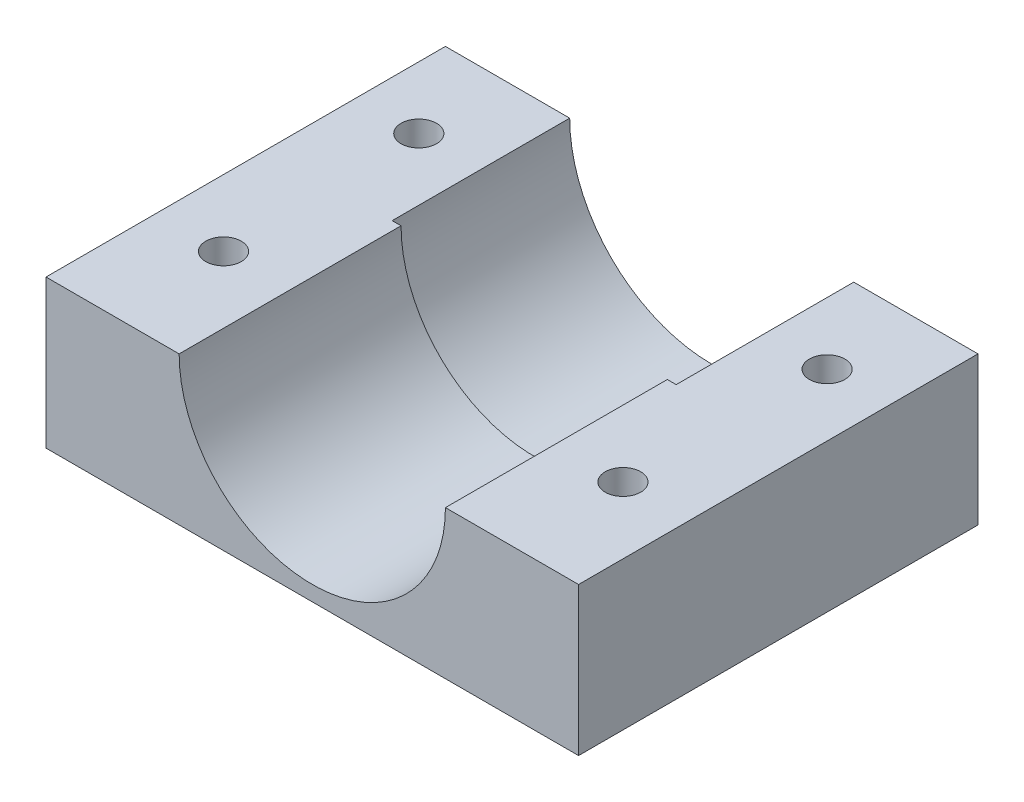
from build123d import *

# Parameters (mm, degrees)
BASE_30_MM_DEPTH = 25
BASE_32_MM_DEPTH = 20
ESQUISSE5_R      = 2
VIDE_VIS_DEPTH   = 16.696819514


with BuildPart() as part:
    # Esquisse1 → BASE - 30 mm (new body)
    with BuildSketch(Plane.XY):
        with BuildLine():
            Line((30, 0), (15, 0))
            ThreePointArc((15, 0), (0, -15), (-15, 0))
            Line((-15, 0), (-30, 0))
            Line((-30, 0), (-30, -16.696819514))
            Line((-30, -16.696819514), (30, -16.696819514))
            Line((30, -16.696819514), (30, 0))
        make_face()
    extrude(amount=BASE_30_MM_DEPTH)

    # Esquisse4 → BASE - 32 mm (add)
    with BuildSketch(Plane.XY):
        with BuildLine():
            Line((20, 0), (30, 0))
            Line((30, 0), (30, -16.696819514))
            Line((30, -16.696819514), (-30, -16.696819514))
            Line((-30, -16.696819514), (-30, 0))
            Line((-30, 0), (-20, 0))
            Line((-20, 0), (-16, 0))
            ThreePointArc((-16, 0), (0, -16), (16, 0))
            Line((16, 0), (20, 0))
        make_face()
    extrude(amount=-BASE_32_MM_DEPTH)

    # Esquisse5 → VIDE VIS (cut)
    with BuildSketch(Plane.XZ.offset(16.696819514)):
        with Locations(Location((-23, -10, 0), (0, 0, 270))):
            Circle(ESQUISSE5_R)
        with Locations(Location((-22.5, 12.5, 0), (0, 0, 270))):
            Circle(ESQUISSE5_R)
        with Locations(Location((22.5, 12.5, 0), (0, 0, 270))):
            Circle(ESQUISSE5_R)
        with Locations(Location((23, -10, 0), (0, 0, 270))):
            Circle(ESQUISSE5_R)
    extrude(amount=-VIDE_VIS_DEPTH, mode=Mode.SUBTRACT)


solid = part.part
